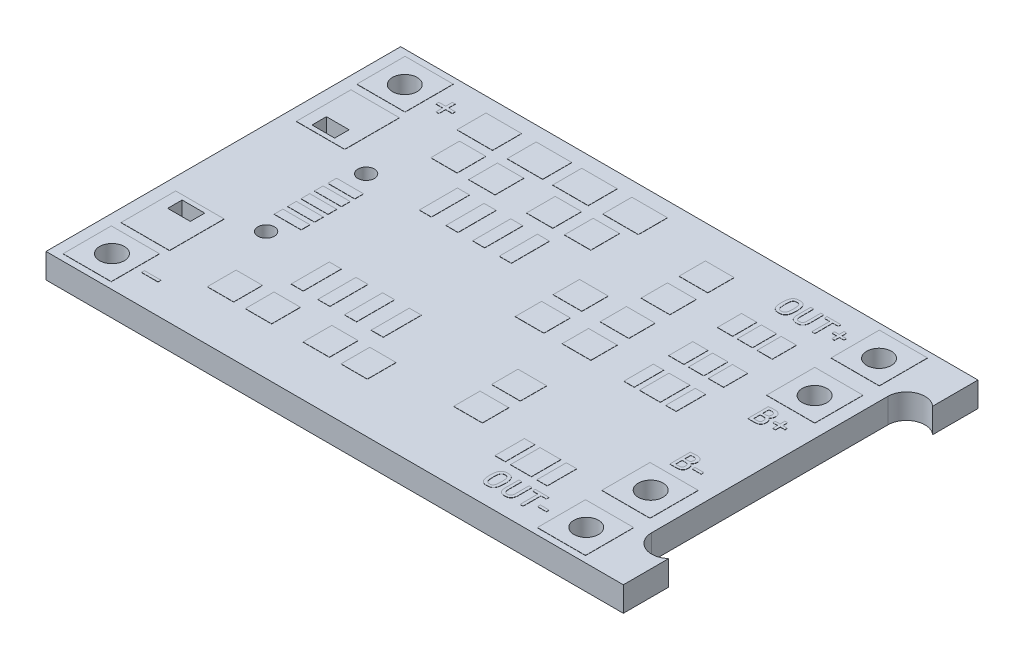
from build123d import *

# Parameters (mm, degrees)
SKETCH1_R                 = 0.6
SKETCH1_R_2               = 0.4
SKETCH1_W                 = 1.1
SKETCH1_H                 = 0.7
PCB_DEPTH                 = 1.2
SKETCH2_W                 = 2.338070763
SKETCH2_H                 = 2.338070764
SKETCH2_R                 = 0.6
SKETCH2_W_2               = 2.349045504
SKETCH2_H_2               = 2.649723328
SKETCH2_W_3               = 1.1
SKETCH2_H_3               = 0.7
SKETCH2_W_4               = 1.724206916
SKETCH2_H_4               = 1.408615472
SKETCH2_W_5               = 1.724206917
SKETCH2_W_6               = 1.277760483
SKETCH2_H_5               = 1.393220768
SKETCH2_W_7               = 0.586321758
SKETCH2_H_6               = 1.84916862
SKETCH2_W_8               = 0.586321757
SKETCH2_W_9               = 1.393220768
SKETCH2_H_7               = 1.277760483
SKETCH2_W_10              = 1.311628833
SKETCH2_H_8               = 0.424893848
SKETCH2_W_11              = 0.738945821
SKETCH2_H_9               = 1.16999755
SKETCH2_W_12              = 0.738945822
SKETCH2_H_10              = 1.169997551
SKETCH2_W_13              = 0.505138745
SKETCH2_H_11              = 1.431226445
SKETCH2_W_14              = 1.010277491
SKETCH2_W_15              = 0.505138746
SKETCH2_H_12              = 1.431226444
SKETCH2_W_16              = 0.8
SKETCH2_H_13              = 0.142340239
PADS_COMPONENT_SIDE_DEPTH = 0.01
PADS_START                = 0.01
SKETCH3_W                 = 2.338070763
SKETCH3_H                 = 2.338070764
SKETCH3_R                 = 0.6
PADS_SOLDER_SIDE_DEPTH    = 0.01
LEGEND_OUT_DEPTH          = 0.01
LEGEND_OUT_2_DEPTH        = 0.01
LEGEND_B_DEPTH            = 0.01
LEGEND_B_2_DEPTH          = 0.01


with BuildPart() as part:
    # Sketch1 → PCB (new body)
    with BuildSketch(Plane(origin=(0, 0, 0), x_dir=(1, 0, 0), z_dir=(0, 1, 0))):
        with BuildLine():
            Line((26.5, 5.729179607), (26.5, -5.729179607))
            ThreePointArc((26.5, -5.729179607), (27.032576539, -6.550763443), (28, -6.4))
            Line((28, -6.4), (28, -8.599973827))
            Line((28, -8.599973827), (0, -8.599973827))
            Line((0, -8.599973827), (0, 8.599973827))
            Line((0, 8.599973827), (28, 8.599973827))
            Line((28, 8.599973827), (28, 6.4))
            ThreePointArc((28, 6.4), (27.032576539, 6.550763443), (26.5, 5.729179607))
        make_face()
        with Locations(Location((24.700000031, 7.100026173, 0), (0, 0, 270))):
            Circle(SKETCH1_R, mode=Mode.SUBTRACT)
        with Locations(Location((1.7, 7.100026173, 0), (0, 0, 270))):
            Circle(SKETCH1_R, mode=Mode.SUBTRACT)
        with Locations(Location((24.700000031, -7.099973827, 0), (0, 0, 270))):
            Circle(SKETCH1_R, mode=Mode.SUBTRACT)
        with Locations(Location((1.7, -7.099973827, 0), (0, 0, 270))):
            Circle(SKETCH1_R, mode=Mode.SUBTRACT)
        with Locations(Location((24.700000031, 3.974726173, 0), (0, 0, 270))):
            Circle(SKETCH1_R, mode=Mode.SUBTRACT)
        with Locations(Location((24.700000031, -3.974973827, 0), (0, 0, 270))):
            Circle(SKETCH1_R, mode=Mode.SUBTRACT)
        with Locations(Location((4.5, 2.425, 0), (0, 0, 270))):
            Circle(SKETCH1_R_2, mode=Mode.SUBTRACT)
        with Locations(Location((4.5, -2.425, 0), (0, 0, 90))):
            Circle(SKETCH1_R_2, mode=Mode.SUBTRACT)
        with Locations((1.7, -3.5)):
            Rectangle(SKETCH1_W, SKETCH1_H, mode=Mode.SUBTRACT)
        with Locations((1.7, 3.5)):
            Rectangle(SKETCH1_W, SKETCH1_H, mode=Mode.SUBTRACT)
    extrude(amount=PCB_DEPTH)

    # Sketch2 → Pads - Component Side (add)
    # profile 1 of 55: a face of its own
    with BuildSketch(Plane(origin=(0, 1.2, 0), x_dir=(1, 0, 0), z_dir=(0, 1, 0))):
        Polygon((3.601592141, 7.180940734), (3.601592141, 7.509770615), (3.743932379, 7.509770615), (3.743932379, 7.180940734), (4.07276226, 7.180940734), (4.07276226, 7.038600496), (3.743932379, 7.038600496), (3.743932379, 6.709770615), (3.601592141, 6.709770615), (3.601592141, 7.038600496), (3.27276226, 7.038600496), (3.27276226, 7.180940734), align=None)
    # profile 2 of 55: a face of its own
    with BuildSketch(Plane(origin=(0, 1.2, 0), x_dir=(1, 0, 0), z_dir=(0, 1, 0))):
        with Locations((1.68941797, 7.123531477)):
            Rectangle(SKETCH2_W, SKETCH2_H)
        with Locations(Location((1.7, 7.100026173, 0), (0, 0, 270))):
            Circle(SKETCH2_R, mode=Mode.SUBTRACT)
    # profile 3 of 55: a face of its own
    with BuildSketch(Plane(origin=(0, 1.2, 0), x_dir=(1, 0, 0), z_dir=(0, 1, 0))):
        with Locations((1.789925252, 4.249464255)):
            Rectangle(SKETCH2_W_2, SKETCH2_H_2)
        with Locations((1.7, 3.5)):
            Rectangle(SKETCH2_W_3, SKETCH2_H_3, mode=Mode.SUBTRACT)
    # profile 4 of 55: a face of its own
    with BuildSketch(Plane(origin=(0, 1.2, 0), x_dir=(1, 0, 0), z_dir=(0, 1, 0))):
        with Locations((1.789925252, -4.249464255)):
            Rectangle(SKETCH2_W_2, SKETCH2_H_2)
        with Locations((1.7, -3.5)):
            Rectangle(SKETCH2_W_3, SKETCH2_H_3, mode=Mode.SUBTRACT)
    # profile 5 of 55: a face of its own
    with BuildSketch(Plane(origin=(0, 1.2, 0), x_dir=(1, 0, 0), z_dir=(0, 1, 0))):
        with Locations((1.68941797, -7.123531477)):
            Rectangle(SKETCH2_W, SKETCH2_H)
        with Locations(Location((1.7, -7.099973827, 0), (0, 0, 270))):
            Circle(SKETCH2_R, mode=Mode.SUBTRACT)
    # profile 6 of 55: a face of its own
    with BuildSketch(Plane(origin=(0, 1.2, 0), x_dir=(1, 0, 0), z_dir=(0, 1, 0))):
        with Locations((5.727104984, 7.170506567)):
            Rectangle(SKETCH2_W_4, SKETCH2_H_4)
    # profile 7 of 55: a face of its own
    with BuildSketch(Plane(origin=(0, 1.2, 0), x_dir=(1, 0, 0), z_dir=(0, 1, 0))):
        with Locations((8.159468313, 7.170506567)):
            Rectangle(SKETCH2_W_4, SKETCH2_H_4)
    # profile 8 of 55: a face of its own
    with BuildSketch(Plane(origin=(0, 1.2, 0), x_dir=(1, 0, 0), z_dir=(0, 1, 0))):
        with Locations((10.368608426, 7.170506567)):
            Rectangle(SKETCH2_W_5, SKETCH2_H_4)
    # profile 9 of 55: a face of its own
    with BuildSketch(Plane(origin=(0, 1.2, 0), x_dir=(1, 0, 0), z_dir=(0, 1, 0))):
        with Locations((12.800971755, 7.170506567)):
            Rectangle(SKETCH2_W_5, SKETCH2_H_4)
    # profile 10 of 55: a face of its own
    with BuildSketch(Plane(origin=(0, 1.2, 0), x_dir=(1, 0, 0), z_dir=(0, 1, 0))):
        with Locations((6.042696429, 5.353931423)):
            Rectangle(SKETCH2_W_6, SKETCH2_H_5)
    # profile 11 of 55: a face of its own
    with BuildSketch(Plane(origin=(0, 1.2, 0), x_dir=(1, 0, 0), z_dir=(0, 1, 0))):
        with Locations((7.882363631, 5.353931423)):
            Rectangle(SKETCH2_W_6, SKETCH2_H_5)
    # profile 12 of 55: a face of its own
    with BuildSketch(Plane(origin=(0, 1.2, 0), x_dir=(1, 0, 0), z_dir=(0, 1, 0))):
        with Locations((10.68419987, 5.353931423)):
            Rectangle(SKETCH2_W_6, SKETCH2_H_5)
    # profile 13 of 55: a face of its own
    with BuildSketch(Plane(origin=(0, 1.2, 0), x_dir=(1, 0, 0), z_dir=(0, 1, 0))):
        with Locations((12.523867071, 5.353931423)):
            Rectangle(SKETCH2_W_6, SKETCH2_H_5)
    # profile 14 of 55: a face of its own
    with BuildSketch(Plane(origin=(0, 1.2, 0), x_dir=(1, 0, 0), z_dir=(0, 1, 0))):
        with Locations((7.615071204, 3.106967226)):
            Rectangle(SKETCH2_W_7, SKETCH2_H_6)
    # profile 15 of 55: a face of its own
    with BuildSketch(Plane(origin=(0, 1.2, 0), x_dir=(1, 0, 0), z_dir=(0, 1, 0))):
        with Locations((8.90798585, 3.106967226)):
            Rectangle(SKETCH2_W_8, SKETCH2_H_6)
    # profile 16 of 55: a face of its own
    with BuildSketch(Plane(origin=(0, 1.2, 0), x_dir=(1, 0, 0), z_dir=(0, 1, 0))):
        with Locations((10.200900495, 3.106967226)):
            Rectangle(SKETCH2_W_7, SKETCH2_H_6)
    # profile 17 of 55: a face of its own
    with BuildSketch(Plane(origin=(0, 1.2, 0), x_dir=(1, 0, 0), z_dir=(0, 1, 0))):
        with Locations((11.49381514, 3.106967226)):
            Rectangle(SKETCH2_W_7, SKETCH2_H_6)
    # profile 18 of 55: a face of its own
    with BuildSketch(Plane(origin=(0, 1.2, 0), x_dir=(1, 0, 0), z_dir=(0, 1, 0))):
        with Locations((17.096721537, 6.341205651)):
            Rectangle(SKETCH2_W_9, SKETCH2_H_7)
    # profile 19 of 55: a face of its own
    with BuildSketch(Plane(origin=(0, 1.2, 0), x_dir=(1, 0, 0), z_dir=(0, 1, 0))):
        with Locations((17.096721537, 4.501538449)):
            Rectangle(SKETCH2_W_9, SKETCH2_H_7)
    # profile 20 of 55: a face of its own
    with BuildSketch(Plane(origin=(0, 1.2, 0), x_dir=(1, 0, 0), z_dir=(0, 1, 0))):
        with Locations((17.096721537, 2.512261479)):
            Rectangle(SKETCH2_W_9, SKETCH2_H_7)
    # profile 21 of 55: a face of its own
    with BuildSketch(Plane(origin=(0, 1.2, 0), x_dir=(1, 0, 0), z_dir=(0, 1, 0))):
        with Locations((17.096721537, 0.672594278)):
            Rectangle(SKETCH2_W_9, SKETCH2_H_7)
    # profile 22 of 55: a face of its own
    with BuildSketch(Plane(origin=(0, 1.2, 0), x_dir=(1, 0, 0), z_dir=(0, 1, 0))):
        with Locations((14.818147398, 2.512261479)):
            Rectangle(SKETCH2_W_9, SKETCH2_H_7)
    # profile 23 of 55: a face of its own
    with BuildSketch(Plane(origin=(0, 1.2, 0), x_dir=(1, 0, 0), z_dir=(0, 1, 0))):
        with Locations((14.818147398, 0.672594278)):
            Rectangle(SKETCH2_W_9, SKETCH2_H_7)
    # profile 24 of 55: a face of its own
    with BuildSketch(Plane(origin=(0, 1.2, 0), x_dir=(1, 0, 0), z_dir=(0, 1, 0))):
        with Locations((4.634015607, 1.3)):
            Rectangle(SKETCH2_W_10, SKETCH2_H_8)
    # profile 25 of 55: a face of its own
    with BuildSketch(Plane(origin=(0, 1.2, 0), x_dir=(1, 0, 0), z_dir=(0, 1, 0))):
        with Locations((4.634015607, 0.65)):
            Rectangle(SKETCH2_W_10, SKETCH2_H_8)
    # profile 26 of 55: a face of its own
    with BuildSketch(Plane(origin=(0, 1.2, 0), x_dir=(1, 0, 0), z_dir=(0, 1, 0))):
        with Locations((4.634015607, 0)):
            Rectangle(SKETCH2_W_10, SKETCH2_H_8)
    # profile 27 of 55: a face of its own
    with BuildSketch(Plane(origin=(0, 1.2, 0), x_dir=(1, 0, 0), z_dir=(0, 1, 0))):
        with Locations((4.634015607, -0.65)):
            Rectangle(SKETCH2_W_10, SKETCH2_H_8)
    # profile 28 of 55: a face of its own
    with BuildSketch(Plane(origin=(0, 1.2, 0), x_dir=(1, 0, 0), z_dir=(0, 1, 0))):
        with Locations((4.634015607, -1.3)):
            Rectangle(SKETCH2_W_10, SKETCH2_H_8)
    # profile 29 of 55: a face of its own
    with BuildSketch(Plane(origin=(0, 1.2, 0), x_dir=(1, 0, 0), z_dir=(0, 1, 0))):
        with Locations((7.615071204, -3.106967226)):
            Rectangle(SKETCH2_W_7, SKETCH2_H_6)
    # profile 30 of 55: a face of its own
    with BuildSketch(Plane(origin=(0, 1.2, 0), x_dir=(1, 0, 0), z_dir=(0, 1, 0))):
        with Locations((8.90798585, -3.106967226)):
            Rectangle(SKETCH2_W_8, SKETCH2_H_6)
    # profile 31 of 55: a face of its own
    with BuildSketch(Plane(origin=(0, 1.2, 0), x_dir=(1, 0, 0), z_dir=(0, 1, 0))):
        with Locations((10.200900495, -3.106967226)):
            Rectangle(SKETCH2_W_7, SKETCH2_H_6)
    # profile 32 of 55: a face of its own
    with BuildSketch(Plane(origin=(0, 1.2, 0), x_dir=(1, 0, 0), z_dir=(0, 1, 0))):
        with Locations((11.49381514, -3.106967226)):
            Rectangle(SKETCH2_W_7, SKETCH2_H_6)
    # profile 33 of 55: a face of its own
    with BuildSketch(Plane(origin=(0, 1.2, 0), x_dir=(1, 0, 0), z_dir=(0, 1, 0))):
        with Locations((6.042696429, -5.481040964)):
            Rectangle(SKETCH2_W_6, SKETCH2_H_5)
    # profile 34 of 55: a face of its own
    with BuildSketch(Plane(origin=(0, 1.2, 0), x_dir=(1, 0, 0), z_dir=(0, 1, 0))):
        with Locations((7.882363631, -5.481040964)):
            Rectangle(SKETCH2_W_6, SKETCH2_H_5)
    # profile 35 of 55: a face of its own
    with BuildSketch(Plane(origin=(0, 1.2, 0), x_dir=(1, 0, 0), z_dir=(0, 1, 0))):
        with Locations((10.68419987, -5.481040964)):
            Rectangle(SKETCH2_W_6, SKETCH2_H_5)
    # profile 36 of 55: a face of its own
    with BuildSketch(Plane(origin=(0, 1.2, 0), x_dir=(1, 0, 0), z_dir=(0, 1, 0))):
        with Locations((12.523867071, -5.481040964)):
            Rectangle(SKETCH2_W_6, SKETCH2_H_5)
    # profile 37 of 55: a face of its own
    with BuildSketch(Plane(origin=(0, 1.2, 0), x_dir=(1, 0, 0), z_dir=(0, 1, 0))):
        with Locations((17.096721537, -2.749600451)):
            Rectangle(SKETCH2_W_9, SKETCH2_H_7)
    # profile 38 of 55: a face of its own
    with BuildSketch(Plane(origin=(0, 1.2, 0), x_dir=(1, 0, 0), z_dir=(0, 1, 0))):
        with Locations((17.096721537, -4.589267652)):
            Rectangle(SKETCH2_W_9, SKETCH2_H_7)
    # profile 39 of 55: a face of its own
    with BuildSketch(Plane(origin=(0, 1.2, 0), x_dir=(1, 0, 0), z_dir=(0, 1, 0))):
        with Locations((19.851062426, 5.06548038)):
            Rectangle(SKETCH2_W_11, SKETCH2_H_9)
    # profile 40 of 55: a face of its own
    with BuildSketch(Plane(origin=(0, 1.2, 0), x_dir=(1, 0, 0), z_dir=(0, 1, 0))):
        with Locations((20.813231464, 5.06548038)):
            Rectangle(SKETCH2_W_12, SKETCH2_H_9)
    # profile 41 of 55: a face of its own
    with BuildSketch(Plane(origin=(0, 1.2, 0), x_dir=(1, 0, 0), z_dir=(0, 1, 0))):
        with Locations((21.775400503, 5.06548038)):
            Rectangle(SKETCH2_W_11, SKETCH2_H_9)
    # profile 42 of 55: a face of its own
    with BuildSketch(Plane(origin=(0, 1.2, 0), x_dir=(1, 0, 0), z_dir=(0, 1, 0))):
        with Locations((19.851062426, 2.702393222)):
            Rectangle(SKETCH2_W_11, SKETCH2_H_10)
    # profile 43 of 55: a face of its own
    with BuildSketch(Plane(origin=(0, 1.2, 0), x_dir=(1, 0, 0), z_dir=(0, 1, 0))):
        with Locations((20.813231464, 2.702393222)):
            Rectangle(SKETCH2_W_12, SKETCH2_H_10)
    # profile 44 of 55: a face of its own
    with BuildSketch(Plane(origin=(0, 1.2, 0), x_dir=(1, 0, 0), z_dir=(0, 1, 0))):
        with Locations((21.775400503, 2.702393222)):
            Rectangle(SKETCH2_W_11, SKETCH2_H_10)
    # profile 45 of 55: a face of its own
    with BuildSketch(Plane(origin=(0, 1.2, 0), x_dir=(1, 0, 0), z_dir=(0, 1, 0))):
        with Locations((19.722615502, 0.670713408)):
            Rectangle(SKETCH2_W_13, SKETCH2_H_11)
    # profile 46 of 55: a face of its own
    with BuildSketch(Plane(origin=(0, 1.2, 0), x_dir=(1, 0, 0), z_dir=(0, 1, 0))):
        with Locations((20.732892992, 0.670713408)):
            Rectangle(SKETCH2_W_14, SKETCH2_H_11)
    # profile 47 of 55: a face of its own
    with BuildSketch(Plane(origin=(0, 1.2, 0), x_dir=(1, 0, 0), z_dir=(0, 1, 0))):
        with Locations((21.755197596, 0.670713408)):
            Rectangle(SKETCH2_W_15, SKETCH2_H_11)
    # profile 48 of 55: a face of its own
    with BuildSketch(Plane(origin=(0, 1.2, 0), x_dir=(1, 0, 0), z_dir=(0, 1, 0))):
        with Locations((19.722615502, -5.583385342)):
            Rectangle(SKETCH2_W_13, SKETCH2_H_12)
    # profile 49 of 55: a face of its own
    with BuildSketch(Plane(origin=(0, 1.2, 0), x_dir=(1, 0, 0), z_dir=(0, 1, 0))):
        with Locations((20.732892992, -5.583385342)):
            Rectangle(SKETCH2_W_14, SKETCH2_H_12)
    # profile 50 of 55: a face of its own
    with BuildSketch(Plane(origin=(0, 1.2, 0), x_dir=(1, 0, 0), z_dir=(0, 1, 0))):
        with Locations((21.755197596, -5.583385342)):
            Rectangle(SKETCH2_W_15, SKETCH2_H_12)
    # profile 51 of 55: a face of its own
    with BuildSketch(Plane(origin=(0, 1.2, 0), x_dir=(1, 0, 0), z_dir=(0, 1, 0))):
        with Locations((24.689418001, -7.123531477)):
            Rectangle(SKETCH2_W, SKETCH2_H)
        with Locations(Location((24.700000031, -7.099973827, 0), (0, 0, 270))):
            Circle(SKETCH2_R, mode=Mode.SUBTRACT)
    # profile 52 of 55: a face of its own
    with BuildSketch(Plane(origin=(0, 1.2, 0), x_dir=(1, 0, 0), z_dir=(0, 1, 0))):
        with Locations((24.689418001, -3.996012293)):
            Rectangle(SKETCH2_W, SKETCH2_H)
        with Locations(Location((24.700000031, -3.974973827, 0), (0, 0, 270))):
            Circle(SKETCH2_R, mode=Mode.SUBTRACT)
    # profile 53 of 55: a face of its own
    with BuildSketch(Plane(origin=(0, 1.2, 0), x_dir=(1, 0, 0), z_dir=(0, 1, 0))):
        with Locations((24.689418001, 3.996012293)):
            Rectangle(SKETCH2_W, SKETCH2_H)
        with Locations(Location((24.700000031, 3.974726173, 0), (0, 0, 270))):
            Circle(SKETCH2_R, mode=Mode.SUBTRACT)
    # profile 54 of 55: a face of its own
    with BuildSketch(Plane(origin=(0, 1.2, 0), x_dir=(1, 0, 0), z_dir=(0, 1, 0))):
        with Locations((24.689418001, 7.123531477)):
            Rectangle(SKETCH2_W, SKETCH2_H)
        with Locations(Location((24.700000031, 7.100026173, 0), (0, 0, 270))):
            Circle(SKETCH2_R, mode=Mode.SUBTRACT)
    # profile 55 of 55: a face of its own
    with BuildSketch(Plane(origin=(0, 1.2, 0), x_dir=(1, 0, 0), z_dir=(0, 1, 0))):
        with Locations((3.601592141, -7.099973827)):
            Rectangle(SKETCH2_W_16, SKETCH2_H_13)
    extrude(amount=PADS_COMPONENT_SIDE_DEPTH)

    # Sketch3 → Pads - Solder side (add)
    # profile 1 of 6: a face of its own
    with BuildSketch(Plane.XZ.offset(PADS_START)):
        with Locations((1.68941797, 7.123531477)):
            Rectangle(SKETCH3_W, SKETCH3_H)
        with Locations(Location((1.7, 7.099973827, 0), (0, 0, 270))):
            Circle(SKETCH3_R, mode=Mode.SUBTRACT)
    # profile 2 of 6: a face of its own
    with BuildSketch(Plane.XZ.offset(PADS_START)):
        with Locations((1.68941797, -7.123531477)):
            Rectangle(SKETCH3_W, SKETCH3_H)
        with Locations(Location((1.7, -7.100026173, 0), (0, 0, 270))):
            Circle(SKETCH3_R, mode=Mode.SUBTRACT)
    # profile 3 of 6: a face of its own
    with BuildSketch(Plane.XZ.offset(PADS_START)):
        with Locations((24.689418001, 7.123531477)):
            Rectangle(SKETCH3_W, SKETCH3_H)
        with Locations(Location((24.700000031, 7.099973827, 0), (0, 0, 270))):
            Circle(SKETCH3_R, mode=Mode.SUBTRACT)
    # profile 4 of 6: a face of its own
    with BuildSketch(Plane.XZ.offset(PADS_START)):
        with Locations((24.689418001, -7.123531477)):
            Rectangle(SKETCH3_W, SKETCH3_H)
        with Locations(Location((24.700000031, -7.100026173, 0), (0, 0, 270))):
            Circle(SKETCH3_R, mode=Mode.SUBTRACT)
    # profile 5 of 6: a face of its own
    with BuildSketch(Plane.XZ.offset(PADS_START)):
        with Locations((24.689418001, -3.996012293)):
            Rectangle(SKETCH3_W, SKETCH3_H)
        with Locations(Location((24.700000031, -3.974726173, 0), (0, 0, 270))):
            Circle(SKETCH3_R, mode=Mode.SUBTRACT)
    # profile 6 of 6: a face of its own
    with BuildSketch(Plane.XZ.offset(PADS_START)):
        with Locations((24.689418001, 3.996012293)):
            Rectangle(SKETCH3_W, SKETCH3_H)
        with Locations(Location((24.700000031, 3.974973827, 0), (0, 0, 270))):
            Circle(SKETCH3_R, mode=Mode.SUBTRACT)
    extrude(amount=-PADS_SOLDER_SIDE_DEPTH)

    # Sketch4 → Legend - Out (add)
    # profile 1 of 4: a face of its own
    with BuildSketch(Plane(origin=(0, 1.2, 0), x_dir=(1, 0, 0), z_dir=(0, 1, 0))):
        with BuildLine():
            Line((22.859051248, 7.137747739), (23.052176248, 7.137747739))
            add(Edge.make_bspline(
                [(23.052176248, 7.137747739), (23.057107042, 7.137430739), (23.066128911, 7.136850725), (23.078201542, 7.130510007), (23.084880308, 7.118649923), (23.085422601, 7.109703164), (23.085717914, 7.104831072)],
                knots=[0, 0, 0, 0, 1.098803929, 2.010480165, 2.916577097, 4, 4, 4, 4], degree=3))
            Line((23.085717914, 7.104831072), (23.085717914, 7.017747739))
            Line((23.085717914, 7.017747739), (22.859051248, 7.017747739))
            Line((22.859051248, 7.017747739), (22.859051248, 6.777747739))
            Line((22.859051248, 6.777747739), (22.759884581, 6.777747739))
            add(Edge.make_bspline(
                [(22.759884581, 6.777747739), (22.754784076, 6.777999665), (22.745495841, 6.778458433), (22.733416921, 6.785542837), (22.726475314, 6.797693035), (22.72598528, 6.807028995), (22.725717914, 6.812122739)],
                knots=[0, 0, 0, 0, 1.094729443, 1.993548665, 2.905270557, 4, 4, 4, 4], degree=3))
            Line((22.725717914, 6.812122739), (22.725717914, 7.017747739))
            Line((22.725717914, 7.017747739), (22.534051248, 7.017747739))
            add(Edge.make_bspline(
                [(22.534051248, 7.017747739), (22.528903185, 7.018039183), (22.519499997, 7.01857152), (22.507171509, 7.025104559), (22.500027583, 7.036817286), (22.499396261, 7.045771172), (22.499051248, 7.050664406)],
                knots=[0, 0, 0, 0, 1.123037422, 2.051282647, 2.935040248, 4, 4, 4, 4], degree=3))
            Line((22.499051248, 7.050664406), (22.499051248, 7.137747739))
            Line((22.499051248, 7.137747739), (22.725717914, 7.137747739))
            Line((22.725717914, 7.137747739), (22.725717914, 7.377747739))
            Line((22.725717914, 7.377747739), (22.824884581, 7.377747739))
            add(Edge.make_bspline(
                [(22.824884581, 7.377747739), (22.829985086, 7.377495813), (22.83927332, 7.377037045), (22.851352241, 7.369952641), (22.858293847, 7.357802443), (22.858783882, 7.348466483), (22.859051248, 7.343372739)],
                knots=[0, 0, 0, 0, 1.094729443, 1.993548665, 2.905270557, 4, 4, 4, 4], degree=3))
            Line((22.859051248, 7.343372739), (22.859051248, 7.137747739))
        make_face()
    # profile 2 of 4: a face of its own
    with BuildSketch(Plane(origin=(0, 1.2, 0), x_dir=(1, 0, 0), z_dir=(0, 1, 0))):
        with BuildLine():
            Line((21.952384581, 7.457747739), (21.720717914, 7.457747739))
            add(Edge.make_bspline(
                [(21.720717914, 7.457747739), (21.715552981, 7.458001802), (21.706048203, 7.458469341), (21.693703018, 7.465617303), (21.686686451, 7.477977496), (21.686061361, 7.487375694), (21.685717914, 7.492539406)],
                knots=[0, 0, 0, 0, 1.09175802, 2.009109741, 2.906132495, 4, 4, 4, 4], degree=3))
            Line((21.685717914, 7.492539406), (21.685717914, 7.591081072))
            Line((21.685717914, 7.591081072), (22.331134581, 7.591081072))
            add(Edge.make_bspline(
                [(22.331134581, 7.591081072), (22.335967088, 7.590713842), (22.345179607, 7.590013768), (22.356979461, 7.582611767), (22.364848046, 7.570792739), (22.365414268, 7.561352114), (22.365717914, 7.556289406)],
                knots=[0, 0, 0, 0, 1.038606084, 1.9799616, 2.916717433, 4, 4, 4, 4], degree=3))
            Line((22.365717914, 7.556289406), (22.365717914, 7.457747739))
            Line((22.365717914, 7.457747739), (22.099051248, 7.457747739))
            Line((22.099051248, 7.457747739), (22.099051248, 6.591081072))
            Line((22.099051248, 6.591081072), (21.985926248, 6.591081072))
            add(Edge.make_bspline(
                [(21.985926248, 6.591081072), (21.980980101, 6.591375419), (21.971895121, 6.591916068), (21.960032655, 6.598536743), (21.953160635, 6.610194235), (21.952659381, 6.61910992), (21.952384581, 6.623997739)],
                knots=[0, 0, 0, 0, 1.100319274, 2.021043931, 2.915082964, 4, 4, 4, 4], degree=3))
            Line((21.952384581, 6.623997739), (21.952384581, 7.457747739))
        make_face()
    # profile 3 of 4: a face of its own
    with BuildSketch(Plane(origin=(0, 1.2, 0), x_dir=(1, 0, 0), z_dir=(0, 1, 0))):
        with BuildLine():
            add(Edge.make_bspline(
                [(21.539051248, 6.946289406), (21.538784103, 6.931006602), (21.538266155, 6.901375774), (21.535069952, 6.858490749), (21.529241262, 6.818747771), (21.52121193, 6.782150683), (21.51082364, 6.748668869), (21.498217679, 6.718184099), (21.48288678, 6.691025322), (21.465598625, 6.66661738), (21.445234198, 6.645521695), (21.422067424, 6.627195251), (21.395889402, 6.611799852), (21.366756069, 6.599252431), (21.334695992, 6.589448127), (21.299621656, 6.582801432), (21.261655766, 6.578537341), (21.23538301, 6.578017366), (21.221759581, 6.577747739)],
                knots=[0, 0, 0, 0, 1.305152066, 2.530474064, 3.669401321, 4.732663706, 5.726763857, 6.659651809, 7.543824186, 8.384882684, 9.206952069, 10.038654786, 10.900101658, 11.792489312, 12.741671524, 13.757001279, 14.836919302, 16, 16, 16, 16], degree=3))
            add(Edge.make_bspline(
                [(21.221759581, 6.577747739), (21.20917856, 6.577885664), (21.184726704, 6.578153729), (21.149135314, 6.582016948), (21.115563153, 6.58711328), (21.084131195, 6.595019455), (21.054990802, 6.60557402), (21.028217565, 6.61913873), (21.00410123, 6.636046379), (20.982128514, 6.655737738), (20.962741678, 6.679052217), (20.945994277, 6.70582339), (20.931460582, 6.7359791), (20.919675299, 6.769820434), (20.910247622, 6.807668416), (20.903867765, 6.849934302), (20.899562417, 6.896617144), (20.899226447, 6.929264642), (20.899051248, 6.946289406)],
                knots=[0, 0, 0, 0, 1.063074196, 2.066138944, 3.023632117, 3.932117013, 4.80139653, 5.639011141, 6.461488956, 7.284532357, 8.126456875, 9.015787792, 9.947980673, 10.950718906, 12.040041054, 13.240791922, 14.56114961, 16, 16, 16, 16], degree=3))
            Line((20.899051248, 6.946289406), (20.899051248, 7.591081072))
            Line((20.899051248, 7.591081072), (21.012176248, 7.591081072))
            add(Edge.make_bspline(
                [(21.012176248, 7.591081072), (21.017107042, 7.590764072), (21.026128911, 7.590184058), (21.038201542, 7.583843341), (21.044880308, 7.571983256), (21.045422601, 7.563036497), (21.045717914, 7.558164406)],
                knots=[0, 0, 0, 0, 1.098803929, 2.010480165, 2.916577097, 4, 4, 4, 4], degree=3))
            Line((21.045717914, 7.558164406), (21.045717914, 6.934206072))
            add(Edge.make_bspline(
                [(21.045717914, 6.934206072), (21.04577514, 6.925870142), (21.045887301, 6.909531938), (21.047426682, 6.885697369), (21.04964983, 6.863021569), (21.052914372, 6.841642791), (21.057352886, 6.821583865), (21.06355719, 6.803110481), (21.070655473, 6.785918587), (21.079689272, 6.770363904), (21.090399968, 6.756493498), (21.102762033, 6.744211331), (21.117095266, 6.734008284), (21.133231017, 6.725457937), (21.151662625, 6.719111852), (21.172375448, 6.714268628), (21.195656411, 6.711733582), (21.211962679, 6.711305468), (21.220509581, 6.711081072)],
                knots=[0, 0, 0, 0, 1.216430547, 2.384171921, 3.484470507, 4.540948917, 5.539181241, 6.478290042, 7.381943698, 8.249403933, 9.094793265, 9.93335007, 10.782860911, 11.653335736, 12.589431493, 13.619570712, 14.752302219, 16, 16, 16, 16], degree=3))
            add(Edge.make_bspline(
                [(21.220509581, 6.711081072), (21.228848118, 6.711305563), (21.244738958, 6.711733379), (21.267402312, 6.714259609), (21.287551647, 6.719137856), (21.305564457, 6.725489834), (21.321366066, 6.734031445), (21.335561949, 6.743984545), (21.347632118, 6.756064596), (21.358280132, 6.769593107), (21.367111863, 6.78488586), (21.374755348, 6.801653179), (21.380434089, 6.82018592), (21.385023282, 6.840171806), (21.388229908, 6.861851948), (21.390735022, 6.884990145), (21.39221354, 6.909811845), (21.392326218, 6.926842969), (21.392384581, 6.935664406)],
                knots=[0, 0, 0, 0, 1.221332142, 2.32750579, 3.331351107, 4.251401777, 5.115762057, 5.953882981, 6.780825146, 7.60670372, 8.468247999, 9.360337453, 10.299410707, 11.300935588, 12.360898675, 13.50633898, 14.708383921, 16, 16, 16, 16], degree=3))
            Line((21.392384581, 6.935664406), (21.392384581, 7.591081072))
            Line((21.392384581, 7.591081072), (21.505509581, 7.591081072))
            add(Edge.make_bspline(
                [(21.505509581, 7.591081072), (21.510206158, 7.590790505), (21.519138804, 7.590237863), (21.530477583, 7.582973322), (21.538078112, 7.571735745), (21.538713627, 7.562736796), (21.539051248, 7.557956072)],
                knots=[0, 0, 0, 0, 1.048069957, 1.993374372, 2.93397315, 4, 4, 4, 4], degree=3))
            Line((21.539051248, 7.557956072), (21.539051248, 6.946289406))
        make_face()
    # profile 4 of 4: a face of its own
    with BuildSketch(Plane(origin=(0, 1.2, 0), x_dir=(1, 0, 0), z_dir=(0, 1, 0))):
        with BuildLine():
            add(Edge.make_bspline(
                [(20.712384581, 7.091081072), (20.712317746, 7.078093376), (20.712187617, 7.052806156), (20.71079669, 7.015791833), (20.709148407, 6.980618217), (20.706036072, 6.94723072), (20.702752588, 6.915639376), (20.69798798, 6.885942909), (20.692910245, 6.858043624), (20.686908955, 6.831886577), (20.679812457, 6.807460818), (20.672859933, 6.784264175), (20.664230969, 6.762824648), (20.655664089, 6.742448102), (20.645983686, 6.7236439), (20.636134594, 6.705880787), (20.62498257, 6.689986982), (20.609881271, 6.670541758), (20.588947471, 6.649349395), (20.561586901, 6.62748336), (20.531336005, 6.61047749), (20.498827988, 6.59787822), (20.464436825, 6.588868606), (20.428409684, 6.582470404), (20.39067361, 6.578374626), (20.364895344, 6.57795935), (20.351759581, 6.577747739)],
                knots=[0, 0, 0, 0, 1.291338966, 2.51425449, 3.682880323, 4.791927438, 5.848055963, 6.840287001, 7.781544293, 8.667613956, 9.507038461, 10.310711405, 11.073692644, 11.803584825, 12.507674271, 13.175728529, 13.821204133, 14.435918619, 15.622501783, 16.773200826, 17.908044666, 19.05824636, 20.230741893, 21.437565722, 22.694267093, 24, 24, 24, 24], degree=3))
            add(Edge.make_bspline(
                [(20.351759581, 6.577747739), (20.33862349, 6.577955928), (20.312913667, 6.578363392), (20.275250456, 6.582490426), (20.239356228, 6.588848007), (20.205155361, 6.597835523), (20.172964264, 6.61053545), (20.142959515, 6.627476875), (20.115798196, 6.64941313), (20.094918609, 6.670560012), (20.079748824, 6.68991581), (20.068913444, 6.706011975), (20.058720869, 6.723565993), (20.049146671, 6.742468396), (20.040462143, 6.762768582), (20.032239894, 6.784356586), (20.024869273, 6.807409223), (20.017887166, 6.831895613), (20.01185103, 6.858040981), (20.006783475, 6.885943677), (20.002015902, 6.915639151), (19.998733284, 6.947230786), (19.995620698, 6.980618198), (19.993972488, 7.015791839), (19.99258154, 7.052806155), (19.992451414, 7.078093376), (19.992384581, 7.091081072)],
                knots=[0, 0, 0, 0, 1.30783659, 2.559684363, 3.768452522, 4.936158407, 6.075352812, 7.206012226, 8.353136179, 9.541631062, 10.157335922, 10.799955299, 11.472544114, 12.177767927, 12.908836047, 13.670570057, 14.477644631, 15.318421543, 16.205918764, 17.148692528, 18.142522161, 19.200352228, 20.311186142, 21.481694763, 22.706580541, 24, 24, 24, 24], degree=3))
            add(Edge.make_bspline(
                [(19.992384581, 7.091081072), (19.992451694, 7.104068743), (19.992582363, 7.129355914), (19.993969455, 7.166370586), (19.995634559, 7.201612083), (19.998704416, 7.23500372), (20.0020352, 7.266590259), (20.006781335, 7.296218722), (20.011851811, 7.324120986), (20.017886099, 7.350266968), (20.024872569, 7.374751454), (20.032228497, 7.397810667), (20.04052423, 7.419435524), (20.04903472, 7.439815991), (20.058786099, 7.458633135), (20.068906315, 7.476152789), (20.079745612, 7.492251053), (20.094974712, 7.511613282), (20.115638276, 7.533006276), (20.143110798, 7.554596438), (20.172838978, 7.571946772), (20.205218808, 7.58424684), (20.239345345, 7.593338397), (20.275253513, 7.599664904), (20.312912851, 7.603800571), (20.338623214, 7.604206832), (20.351759581, 7.604414406)],
                knots=[0, 0, 0, 0, 1.293323479, 2.518118364, 3.688540126, 4.806181222, 5.857060151, 6.850816036, 7.793519841, 8.680951204, 9.521665726, 10.328680409, 11.090357895, 11.827723287, 12.5267297, 13.199268605, 13.841840295, 14.457499467, 15.650866114, 16.793623023, 17.927641074, 19.064207886, 20.23182712, 21.440505581, 22.692260459, 24, 24, 24, 24], degree=3))
            add(Edge.make_bspline(
                [(20.351759581, 7.604414406), (20.364895615, 7.604203404), (20.390674412, 7.603789323), (20.428406669, 7.599684953), (20.464447513, 7.593317608), (20.498765174, 7.58420397), (20.531460783, 7.572005812), (20.561436038, 7.554589105), (20.589107158, 7.533070428), (20.609825415, 7.511631683), (20.624985789, 7.492179907), (20.636141838, 7.476284044), (20.645919443, 7.458555791), (20.655776057, 7.439836323), (20.664167915, 7.419379083), (20.672871225, 7.397903039), (20.679809189, 7.374699869), (20.686910015, 7.350276001), (20.692909466, 7.324118344), (20.697990119, 7.29621949), (20.702733295, 7.266590036), (20.706064941, 7.235003786), (20.709134546, 7.201612064), (20.710799722, 7.166370592), (20.712186794, 7.129355912), (20.712317467, 7.104068742), (20.712384581, 7.091081072)],
                knots=[0, 0, 0, 0, 1.305634511, 2.56224118, 3.768974067, 4.941381244, 6.088985703, 7.227162895, 8.373520409, 9.56496613, 10.179634293, 10.825061256, 11.493065171, 12.190946414, 12.927124891, 13.690048634, 14.493661016, 15.333022264, 16.219025156, 17.160211518, 18.152367784, 19.201555145, 20.317397207, 21.485934976, 22.708758345, 24, 24, 24, 24], degree=3))
        make_face()
        with BuildLine():
            add(Edge.make_bspline(
                [(20.152384581, 7.091081072), (20.152508341, 7.073787794), (20.152745485, 7.040651113), (20.15441977, 6.993205551), (20.15699264, 6.95018149), (20.1609018, 6.911454104), (20.166068348, 6.876657381), (20.173498632, 6.84565964), (20.181986582, 6.817976174), (20.192642148, 6.793757123), (20.205121813, 6.772848856), (20.219734071, 6.755205393), (20.23621092, 6.740688802), (20.25487359, 6.729390904), (20.275647707, 6.721027165), (20.298864811, 6.715307855), (20.3244988, 6.711774665), (20.342441913, 6.711318141), (20.351759581, 6.711081072)],
                knots=[0, 0, 0, 0, 1.686764045, 3.232109191, 4.63025915, 5.889978029, 7.028114374, 8.058267767, 8.996560439, 9.848696707, 10.632833935, 11.363950177, 12.074442337, 12.764491927, 13.481476844, 14.250339606, 15.091419963, 16, 16, 16, 16], degree=3))
            add(Edge.make_bspline(
                [(20.351759581, 6.711081072), (20.361077221, 6.711318164), (20.37902028, 6.711774732), (20.404654639, 6.715307619), (20.427870502, 6.721027947), (20.448648821, 6.729388237), (20.467296447, 6.740698481), (20.48379775, 6.755138296), (20.498161719, 6.772927026), (20.510694518, 6.793741339), (20.521279194, 6.818016194), (20.530042347, 6.84564244), (20.537677472, 6.876648119), (20.542979251, 6.911461756), (20.547457029, 6.950159607), (20.550113251, 6.993205252), (20.552091588, 7.040645814), (20.552284114, 7.073786864), (20.552384581, 7.091081072)],
                knots=[0, 0, 0, 0, 0.908434488, 1.749380107, 2.518119702, 3.234989761, 3.924928809, 4.635307152, 5.361995412, 6.146007026, 6.998006786, 7.938224768, 8.969792823, 10.108814485, 11.3697874, 12.768156265, 14.313506166, 16, 16, 16, 16], degree=3))
            add(Edge.make_bspline(
                [(20.552384581, 7.091081072), (20.552284113, 7.108375279), (20.552091584, 7.141516327), (20.550113266, 7.188956906), (20.547456982, 7.232002496), (20.542979402, 7.270700522), (20.537676989, 7.305513598), (20.530043907, 7.336521085), (20.521274132, 7.36414147), (20.510710934, 7.388435335), (20.498079389, 7.409233164), (20.483941702, 7.427235144), (20.467213806, 7.441440275), (20.448660854, 7.452786915), (20.427866973, 7.461130383), (20.404655707, 7.46685568), (20.379019977, 7.470387085), (20.361077117, 7.470843869), (20.351759581, 7.471081072)],
                knots=[0, 0, 0, 0, 1.686407966, 3.231679185, 4.629976851, 5.890885564, 7.029849233, 8.061364765, 9.001534875, 9.853491256, 10.637462951, 11.369365401, 12.075271029, 12.765174949, 13.482008509, 14.250708963, 15.091611766, 16, 16, 16, 16], degree=3))
            add(Edge.make_bspline(
                [(20.351759581, 7.471081072), (20.342442016, 7.470843892), (20.324499102, 7.470387151), (20.298863744, 7.466855445), (20.275651233, 7.46113116), (20.254861568, 7.452784267), (20.236293553, 7.441449859), (20.219589885, 7.427169156), (20.205203802, 7.409310705), (20.192625774, 7.388419664), (20.181991619, 7.364181466), (20.17349708, 7.336503892), (20.166068829, 7.305504334), (20.16090165, 7.270708175), (20.156992687, 7.231980613), (20.154419755, 7.188956607), (20.152745489, 7.141511028), (20.152508342, 7.108374349), (20.152384581, 7.091081072)],
                knots=[0, 0, 0, 0, 0.908535516, 1.749574658, 2.518399745, 3.235349528, 3.925365305, 4.631385385, 5.36768709, 6.151785894, 7.003880406, 7.9421271, 8.972230014, 10.110310589, 11.369967739, 12.768049187, 14.313318609, 16, 16, 16, 16], degree=3))
        make_face(mode=Mode.SUBTRACT)
    extrude(amount=LEGEND_OUT_DEPTH)

    # Sketch5 → Legend - Out 2 (add)
    # profile 1 of 4: a face of its own
    with BuildSketch(Plane(origin=(0, 1.2, 0), x_dir=(1, 0, 0), z_dir=(0, 1, 0))):
        with BuildLine():
            add(Edge.make_bspline(
                [(23.040371989, -7.272368757), (23.045465733, -7.272636122), (23.054801692, -7.273126157), (23.066951891, -7.280067763), (23.074036295, -7.292146684), (23.074495063, -7.301434919), (23.074746989, -7.306535423)],
                knots=[0, 0, 0, 0, 1.094729443, 2.006451335, 2.905270557, 4, 4, 4, 4], degree=3))
            Line((23.074746989, -7.306535423), (23.074746989, -7.40570209))
            Line((23.074746989, -7.40570209), (22.682455322, -7.40570209))
            add(Edge.make_bspline(
                [(22.682455322, -7.40570209), (22.677361578, -7.405434725), (22.668025618, -7.40494469), (22.65587542, -7.398003083), (22.648791016, -7.385924163), (22.648332248, -7.376635928), (22.648080322, -7.371535423)],
                knots=[0, 0, 0, 0, 1.094729443, 2.006451335, 2.905270557, 4, 4, 4, 4], degree=3))
            Line((22.648080322, -7.371535423), (22.648080322, -7.272368757))
            Line((22.648080322, -7.272368757), (23.040371989, -7.272368757))
        make_face()
    # profile 2 of 4: a face of its own
    with BuildSketch(Plane(origin=(0, 1.2, 0), x_dir=(1, 0, 0), z_dir=(0, 1, 0))):
        with BuildLine():
            Line((22.128080322, -6.872368757), (21.896413655, -6.872368757))
            add(Edge.make_bspline(
                [(21.896413655, -6.872368757), (21.891248722, -6.872114694), (21.881743944, -6.871647154), (21.869398759, -6.864499192), (21.862382192, -6.852139), (21.861757102, -6.842740802), (21.861413655, -6.83757709)],
                knots=[0, 0, 0, 0, 1.09175802, 2.009109741, 2.906132495, 4, 4, 4, 4], degree=3))
            Line((21.861413655, -6.83757709), (21.861413655, -6.739035423))
            Line((21.861413655, -6.739035423), (22.506830322, -6.739035423))
            add(Edge.make_bspline(
                [(22.506830322, -6.739035423), (22.511662829, -6.739402653), (22.520875348, -6.740102728), (22.532675202, -6.747504729), (22.540543787, -6.759323757), (22.541110009, -6.768764382), (22.541413655, -6.77382709)],
                knots=[0, 0, 0, 0, 1.038606084, 1.9799616, 2.916717433, 4, 4, 4, 4], degree=3))
            Line((22.541413655, -6.77382709), (22.541413655, -6.872368757))
            Line((22.541413655, -6.872368757), (22.274746989, -6.872368757))
            Line((22.274746989, -6.872368757), (22.274746989, -7.739035423))
            Line((22.274746989, -7.739035423), (22.161621989, -7.739035423))
            add(Edge.make_bspline(
                [(22.161621989, -7.739035423), (22.156675842, -7.738741077), (22.147590862, -7.738200427), (22.135728396, -7.731579753), (22.128856376, -7.71992226), (22.128355123, -7.711006575), (22.128080322, -7.706118757)],
                knots=[0, 0, 0, 0, 1.100319274, 2.021043931, 2.915082964, 4, 4, 4, 4], degree=3))
            Line((22.128080322, -7.706118757), (22.128080322, -6.872368757))
        make_face()
    # profile 3 of 4: a face of its own
    with BuildSketch(Plane(origin=(0, 1.2, 0), x_dir=(1, 0, 0), z_dir=(0, 1, 0))):
        with BuildLine():
            add(Edge.make_bspline(
                [(21.714746989, -7.38382709), (21.714479844, -7.399109893), (21.713961896, -7.428740722), (21.710765693, -7.471625747), (21.704937003, -7.511368724), (21.696907671, -7.547965812), (21.686519381, -7.581447627), (21.67391342, -7.611932396), (21.658582521, -7.639091174), (21.641294366, -7.663499115), (21.62092994, -7.6845948), (21.597763165, -7.702921244), (21.571585143, -7.718316643), (21.54245181, -7.730864065), (21.510391733, -7.740668368), (21.475317397, -7.747315063), (21.437351507, -7.751579154), (21.411078751, -7.752099129), (21.397455322, -7.752368757)],
                knots=[0, 0, 0, 0, 1.305152066, 2.530474064, 3.669401321, 4.732663706, 5.726763857, 6.659651809, 7.543824186, 8.384882684, 9.206952069, 10.038654786, 10.900101658, 11.792489312, 12.741671524, 13.757001279, 14.836919302, 16, 16, 16, 16], degree=3))
            add(Edge.make_bspline(
                [(21.397455322, -7.752368757), (21.384874301, -7.752230831), (21.360422445, -7.751962767), (21.324831055, -7.748099547), (21.291258894, -7.743003216), (21.259826936, -7.73509704), (21.230686543, -7.724542475), (21.203913306, -7.710977766), (21.179796971, -7.694070116), (21.157824255, -7.674378757), (21.13843742, -7.651064279), (21.121690019, -7.624293105), (21.107156324, -7.594137396), (21.09537104, -7.560296062), (21.085943363, -7.52244808), (21.079563506, -7.480182194), (21.075258158, -7.433499351), (21.074922188, -7.400851853), (21.074746989, -7.38382709)],
                knots=[0, 0, 0, 0, 1.063074196, 2.066138944, 3.023632117, 3.932117013, 4.80139653, 5.639011141, 6.461488956, 7.284532357, 8.126456875, 9.015787792, 9.947980673, 10.950718906, 12.040041054, 13.240791922, 14.56114961, 16, 16, 16, 16], degree=3))
            Line((21.074746989, -7.38382709), (21.074746989, -6.739035423))
            Line((21.074746989, -6.739035423), (21.187871989, -6.739035423))
            add(Edge.make_bspline(
                [(21.187871989, -6.739035423), (21.192802783, -6.739352423), (21.201824652, -6.739932437), (21.213897283, -6.746273155), (21.220576049, -6.758133239), (21.221118342, -6.767079998), (21.221413655, -6.77195209)],
                knots=[0, 0, 0, 0, 1.098803929, 2.010480165, 2.916577097, 4, 4, 4, 4], degree=3))
            Line((21.221413655, -6.77195209), (21.221413655, -7.395910423))
            add(Edge.make_bspline(
                [(21.221413655, -7.395910423), (21.221470881, -7.404246353), (21.221583042, -7.420584558), (21.223122423, -7.444419126), (21.225345571, -7.467094926), (21.228610114, -7.488473705), (21.233048627, -7.50853263), (21.239252931, -7.527006014), (21.246351214, -7.544197908), (21.255385013, -7.559752591), (21.266095709, -7.573622997), (21.278457775, -7.585905164), (21.292791007, -7.596108211), (21.308926759, -7.604658558), (21.327358366, -7.611004644), (21.34807119, -7.615847867), (21.371352152, -7.618382913), (21.38765842, -7.618811028), (21.396205322, -7.619035423)],
                knots=[0, 0, 0, 0, 1.216430547, 2.384171921, 3.484470507, 4.540948917, 5.539181241, 6.478290042, 7.381943698, 8.249403933, 9.094793265, 9.93335007, 10.782860911, 11.653335736, 12.589431493, 13.619570712, 14.752302219, 16, 16, 16, 16], degree=3))
            add(Edge.make_bspline(
                [(21.396205322, -7.619035423), (21.404543859, -7.618810932), (21.420434699, -7.618383117), (21.443098053, -7.615856887), (21.463247389, -7.61097864), (21.481260199, -7.604626661), (21.497061807, -7.596085051), (21.51125769, -7.58613195), (21.523327859, -7.574051899), (21.533975873, -7.560523388), (21.542807604, -7.545230636), (21.55045109, -7.528463317), (21.55612983, -7.509930575), (21.560719023, -7.48994469), (21.563925649, -7.468264547), (21.566430763, -7.445126351), (21.567909281, -7.420304651), (21.568021959, -7.403273527), (21.568080322, -7.39445209)],
                knots=[0, 0, 0, 0, 1.221332142, 2.32750579, 3.331351107, 4.251401777, 5.115762057, 5.953882981, 6.780825146, 7.60670372, 8.468247999, 9.360337453, 10.299410707, 11.300935588, 12.360898675, 13.50633898, 14.708383921, 16, 16, 16, 16], degree=3))
            Line((21.568080322, -7.39445209), (21.568080322, -6.739035423))
            Line((21.568080322, -6.739035423), (21.681205322, -6.739035423))
            add(Edge.make_bspline(
                [(21.681205322, -6.739035423), (21.6859019, -6.73932599), (21.694834545, -6.739878633), (21.706173324, -6.747143174), (21.713773853, -6.75838075), (21.714409369, -6.7673797), (21.714746989, -6.772160423)],
                knots=[0, 0, 0, 0, 1.048069957, 1.993374372, 2.93397315, 4, 4, 4, 4], degree=3))
            Line((21.714746989, -6.772160423), (21.714746989, -7.38382709))
        make_face()
    # profile 4 of 4: a face of its own
    with BuildSketch(Plane(origin=(0, 1.2, 0), x_dir=(1, 0, 0), z_dir=(0, 1, 0))):
        with BuildLine():
            add(Edge.make_bspline(
                [(20.888080322, -7.239035423), (20.888013487, -7.252023119), (20.887883358, -7.277310339), (20.886492431, -7.314324662), (20.884844149, -7.349498278), (20.881731813, -7.382885775), (20.878448329, -7.414477119), (20.873683721, -7.444173587), (20.868605986, -7.472072871), (20.862604696, -7.498229918), (20.855508198, -7.522655677), (20.848555674, -7.54585232), (20.83992671, -7.567291848), (20.83135983, -7.587668394), (20.821679427, -7.606472596), (20.811830335, -7.624235709), (20.800678311, -7.640129514), (20.785577013, -7.659574737), (20.764643213, -7.680767101), (20.737282642, -7.702633135), (20.707031746, -7.719639006), (20.674523729, -7.732238275), (20.640132566, -7.74124789), (20.604105425, -7.747646092), (20.566369352, -7.75174187), (20.540591085, -7.752157146), (20.527455322, -7.752368757)],
                knots=[0, 0, 0, 0, 1.291338966, 2.51425449, 3.682880323, 4.791927438, 5.848055963, 6.840287001, 7.781544293, 8.667613956, 9.507038461, 10.310711405, 11.073692644, 11.803584825, 12.507674271, 13.175728529, 13.821204133, 14.435918619, 15.622501783, 16.773200826, 17.908044666, 19.05824636, 20.230741893, 21.437565722, 22.694267093, 24, 24, 24, 24], degree=3))
            add(Edge.make_bspline(
                [(20.527455322, -7.752368757), (20.514319231, -7.752160568), (20.488609408, -7.751753103), (20.450946197, -7.74762607), (20.415051969, -7.741268488), (20.380851102, -7.732280972), (20.348660005, -7.719581046), (20.318655256, -7.70263962), (20.291493937, -7.680703366), (20.27061435, -7.659556483), (20.255444565, -7.640200685), (20.244609185, -7.62410452), (20.234416611, -7.606550503), (20.224842412, -7.587648099), (20.216157884, -7.567347914), (20.207935635, -7.545759909), (20.200565014, -7.522707272), (20.193582907, -7.498220883), (20.187546771, -7.472075514), (20.182479216, -7.444172818), (20.177711643, -7.414477344), (20.174429026, -7.38288571), (20.171316439, -7.349498297), (20.169668229, -7.314324657), (20.168277281, -7.277310341), (20.168147155, -7.25202312), (20.168080322, -7.239035423)],
                knots=[0, 0, 0, 0, 1.30783659, 2.559684363, 3.768452522, 4.936158407, 6.075352812, 7.206012226, 8.353136179, 9.541631062, 10.157335922, 10.799955299, 11.472544114, 12.177767927, 12.908836047, 13.670570057, 14.477644631, 15.318421543, 16.205918764, 17.148692528, 18.142522161, 19.200352228, 20.311186142, 21.481694763, 22.706580541, 24, 24, 24, 24], degree=3))
            add(Edge.make_bspline(
                [(20.168080322, -7.239035423), (20.168147435, -7.226047753), (20.168278104, -7.200760582), (20.169665197, -7.163745909), (20.1713303, -7.128504413), (20.174400157, -7.095112775), (20.177730941, -7.063526236), (20.182477076, -7.033897774), (20.187547552, -7.00599551), (20.19358184, -6.979849527), (20.20056831, -6.955365042), (20.207924238, -6.932305828), (20.216219971, -6.910680971), (20.224730461, -6.890300504), (20.23448184, -6.871483361), (20.244602056, -6.853963706), (20.255441353, -6.837865442), (20.270670453, -6.818503213), (20.291334017, -6.797110219), (20.318806539, -6.775520058), (20.348534719, -6.758169723), (20.380914549, -6.745869655), (20.415041086, -6.736778098), (20.450949254, -6.730451592), (20.488608592, -6.726315924), (20.514318955, -6.725909664), (20.527455322, -6.72570209)],
                knots=[0, 0, 0, 0, 1.293323479, 2.518118364, 3.688540126, 4.806181222, 5.857060151, 6.850816036, 7.793519841, 8.680951204, 9.521665726, 10.328680409, 11.090357895, 11.827723287, 12.5267297, 13.199268605, 13.841840295, 14.457499467, 15.650866114, 16.793623023, 17.927641074, 19.064207886, 20.23182712, 21.440505581, 22.692260459, 24, 24, 24, 24], degree=3))
            add(Edge.make_bspline(
                [(20.527455322, -6.72570209), (20.540591356, -6.725913092), (20.566370153, -6.726327173), (20.604102411, -6.730431543), (20.640143254, -6.736798888), (20.674460915, -6.745912526), (20.707156524, -6.758110683), (20.73713178, -6.775527391), (20.764802899, -6.797046068), (20.785521156, -6.818484812), (20.80068153, -6.837936589), (20.811837579, -6.853832451), (20.821615184, -6.871560705), (20.831471798, -6.890280172), (20.839863656, -6.910737412), (20.848566967, -6.932213457), (20.85550493, -6.955416627), (20.862605757, -6.979840495), (20.868605207, -7.005998152), (20.87368586, -7.033897006), (20.878429036, -7.06352646), (20.881760682, -7.09511271), (20.884830287, -7.128504431), (20.886495463, -7.163745904), (20.887882536, -7.200760583), (20.888013208, -7.226047753), (20.888080322, -7.239035423)],
                knots=[0, 0, 0, 0, 1.305634511, 2.56224118, 3.768974067, 4.941381244, 6.088985703, 7.227162895, 8.373520409, 9.56496613, 10.179634293, 10.825061256, 11.493065171, 12.190946414, 12.927124891, 13.690048634, 14.493661016, 15.333022264, 16.219025156, 17.160211518, 18.152367784, 19.201555145, 20.317397207, 21.485934976, 22.708758345, 24, 24, 24, 24], degree=3))
        make_face()
        with BuildLine():
            add(Edge.make_bspline(
                [(20.328080322, -7.239035423), (20.328204082, -7.256328701), (20.328441226, -7.289465383), (20.330115511, -7.336910945), (20.332688382, -7.379935006), (20.336597541, -7.418662392), (20.34176409, -7.453459115), (20.349194373, -7.484456855), (20.357682323, -7.512140321), (20.36833789, -7.536359373), (20.380817554, -7.55726764), (20.395429812, -7.574911103), (20.411906661, -7.589427693), (20.430569331, -7.600725592), (20.451343448, -7.609089331), (20.474560552, -7.61480864), (20.500194541, -7.61834183), (20.518137654, -7.618798355), (20.527455322, -7.619035423)],
                knots=[0, 0, 0, 0, 1.686764045, 3.232109191, 4.63025915, 5.889978029, 7.028114374, 8.058267767, 8.996560439, 9.848696707, 10.632833935, 11.363950177, 12.074442337, 12.764491927, 13.481476844, 14.250339606, 15.091419963, 16, 16, 16, 16], degree=3))
            add(Edge.make_bspline(
                [(20.527455322, -7.619035423), (20.536772962, -7.618798332), (20.554716021, -7.618341763), (20.58035038, -7.614808877), (20.603566243, -7.609088549), (20.624344562, -7.600728258), (20.642992188, -7.589418014), (20.659493491, -7.5749782), (20.67385746, -7.55718947), (20.686390259, -7.536375156), (20.696974935, -7.512100302), (20.705738088, -7.484474056), (20.713373213, -7.453468377), (20.718674992, -7.418654739), (20.72315277, -7.379956889), (20.725808992, -7.336911244), (20.727787329, -7.289470682), (20.727979855, -7.256329631), (20.728080322, -7.239035423)],
                knots=[0, 0, 0, 0, 0.908434488, 1.749380107, 2.518119702, 3.234989761, 3.924928809, 4.635307152, 5.361995412, 6.146007026, 6.998006786, 7.938224768, 8.969792823, 10.108814485, 11.3697874, 12.768156265, 14.313506166, 16, 16, 16, 16], degree=3))
            add(Edge.make_bspline(
                [(20.728080322, -7.239035423), (20.727979854, -7.221741217), (20.727787325, -7.188600169), (20.725809007, -7.14115959), (20.723152723, -7.098113999), (20.718675143, -7.059415974), (20.71337273, -7.024602897), (20.705739648, -6.99359541), (20.696969873, -6.965975025), (20.686406675, -6.94168116), (20.67377513, -6.920883332), (20.659637443, -6.902881351), (20.642909548, -6.888676221), (20.624356595, -6.877329581), (20.603562714, -6.868986112), (20.580351448, -6.863260815), (20.554715718, -6.859729411), (20.536772858, -6.859272626), (20.527455322, -6.859035423)],
                knots=[0, 0, 0, 0, 1.686407966, 3.231679185, 4.629976851, 5.890885564, 7.029849233, 8.061364765, 9.001534875, 9.853491256, 10.637462951, 11.369365401, 12.075271029, 12.765174949, 13.482008509, 14.250708963, 15.091611766, 16, 16, 16, 16], degree=3))
            add(Edge.make_bspline(
                [(20.527455322, -6.859035423), (20.518137758, -6.859272604), (20.500194844, -6.859729344), (20.474559485, -6.86326105), (20.451346974, -6.868985336), (20.430557309, -6.877332228), (20.411989294, -6.888666637), (20.395285626, -6.902947339), (20.380899543, -6.92080579), (20.368321515, -6.941696832), (20.35768736, -6.965935029), (20.349192821, -6.993612604), (20.341764571, -7.024612162), (20.336597391, -7.059408321), (20.332688428, -7.098135883), (20.330115496, -7.141159889), (20.32844123, -7.188605467), (20.328204083, -7.221742146), (20.328080322, -7.239035423)],
                knots=[0, 0, 0, 0, 0.908535516, 1.749574658, 2.518399745, 3.235349528, 3.925365305, 4.631385385, 5.36768709, 6.151785894, 7.003880406, 7.9421271, 8.972230014, 10.110310589, 11.369967739, 12.768049187, 14.313318609, 16, 16, 16, 16], degree=3))
        make_face(mode=Mode.SUBTRACT)
    extrude(amount=LEGEND_OUT_2_DEPTH)

    # Sketch6 → Legend - B (add)
    # profile 1 of 2: a face of its own
    with BuildSketch(Plane(origin=(0, 1.2, 0), x_dir=(1, 0, 0), z_dir=(0, 1, 0))):
        with BuildLine():
            add(Edge.make_bspline(
                [(24.042732134, 2.382674386), (24.053419233, 2.384524026), (24.075448113, 2.388336615), (24.109614529, 2.393357002), (24.145907813, 2.397559983), (24.183588756, 2.401823206), (24.221389815, 2.404989494), (24.257912732, 2.407587526), (24.292510276, 2.409119323), (24.314952978, 2.409268549), (24.325857134, 2.409341052)],
                knots=[0, 0, 0, 0, 0.914309261, 1.884628299, 2.910655352, 3.994177363, 5.081251941, 6.108147094, 7.080812095, 8, 8, 8, 8], degree=3))
            add(Edge.make_bspline(
                [(24.325857134, 2.409341052), (24.337318715, 2.409176537), (24.35985325, 2.408853084), (24.392850688, 2.40645214), (24.424310412, 2.401882312), (24.454273579, 2.396353312), (24.482496591, 2.388376352), (24.508748351, 2.378549673), (24.53282815, 2.366283633), (24.554820172, 2.351966112), (24.574602647, 2.335075543), (24.592325781, 2.315851344), (24.607297638, 2.293696747), (24.620112902, 2.269134022), (24.630409007, 2.241825503), (24.637564998, 2.21158956), (24.641973664, 2.178568282), (24.642473387, 2.155605647), (24.642732134, 2.143716052)],
                knots=[0, 0, 0, 0, 1.160160045, 2.280982602, 3.345646565, 4.376810025, 5.362629791, 6.310400584, 7.209479951, 8.092646134, 8.960290725, 9.835984455, 10.730905029, 11.658387622, 12.634941675, 13.676617146, 14.796998781, 16, 16, 16, 16], degree=3))
            add(Edge.make_bspline(
                [(24.642732134, 2.143716052), (24.642415252, 2.13022263), (24.641805976, 2.104278502), (24.635991641, 2.0671542), (24.626136485, 2.033625973), (24.612749587, 2.003394495), (24.594649417, 1.97690155), (24.572389814, 1.953721087), (24.54541586, 1.934200698), (24.525056554, 1.92438101), (24.514607134, 1.919341052)],
                knots=[0, 0, 0, 0, 1.173598915, 2.256506929, 3.258439508, 4.207668312, 5.121138189, 6.035726732, 6.99183611, 8, 8, 8, 8], degree=3))
            add(Edge.make_bspline(
                [(24.514607134, 1.919341052), (24.521595695, 1.916595883), (24.535293211, 1.911215377), (24.554568661, 1.901633047), (24.572338921, 1.891164358), (24.588319351, 1.879580452), (24.602552313, 1.866898684), (24.615520527, 1.853654044), (24.626243267, 1.838878289), (24.638897527, 1.818193589), (24.651143082, 1.789735383), (24.661729378, 1.753059657), (24.668366126, 1.713328861), (24.669047278, 1.685826067), (24.6693988, 1.671632719)],
                knots=[0, 0, 0, 0, 0.858446466, 1.682547051, 2.458993084, 3.215228669, 3.935530893, 4.63778334, 5.330402114, 6.018313959, 7.40866566, 8.856477872, 10.37772478, 12, 12, 12, 12], degree=3))
            add(Edge.make_bspline(
                [(24.6693988, 1.671632719), (24.669144162, 1.658979464), (24.668654206, 1.634633013), (24.664231005, 1.599681073), (24.657142443, 1.567831407), (24.646779834, 1.539240392), (24.634144271, 1.513530316), (24.618655945, 1.490928105), (24.601444874, 1.470561756), (24.581354186, 1.453545719), (24.559535434, 1.438821678), (24.535774108, 1.426567998), (24.510314321, 1.416199491), (24.482896968, 1.408765398), (24.454090998, 1.402846056), (24.423917362, 1.399116501), (24.392502445, 1.396434728), (24.371141064, 1.396152069), (24.360232134, 1.396007719)],
                knots=[0, 0, 0, 0, 1.275250608, 2.453742101, 3.545849361, 4.55799996, 5.513032132, 6.425753449, 7.314306841, 8.192984646, 9.07074139, 9.963285827, 10.883815637, 11.836920914, 12.822843056, 13.846767583, 14.900377229, 16, 16, 16, 16], degree=3))
            Line((24.360232134, 1.396007719), (24.076690467, 1.396007719))
            add(Edge.make_bspline(
                [(24.076690467, 1.396007719), (24.071669171, 1.396288752), (24.062504177, 1.396801701), (24.050533793, 1.403534371), (24.043468671, 1.415286187), (24.042992212, 1.424378151), (24.042732134, 1.429341052)],
                knots=[0, 0, 0, 0, 1.101347924, 2.010207508, 2.913860176, 4, 4, 4, 4], degree=3))
            Line((24.042732134, 1.429341052), (24.042732134, 2.382674386))
        make_face()
        with BuildLine():
            Line((24.1893988, 1.529341052), (24.342732134, 1.529341052))
            add(Edge.make_bspline(
                [(24.342732134, 1.529341052), (24.349610572, 1.529392814), (24.362898262, 1.529492807), (24.382152674, 1.531055659), (24.399985649, 1.533211319), (24.416470204, 1.53649462), (24.431486165, 1.541157794), (24.445405505, 1.546608424), (24.457770429, 1.553861081), (24.468988199, 1.562149166), (24.478661809, 1.572136828), (24.487037065, 1.583498994), (24.494232769, 1.59632932), (24.499810092, 1.610949897), (24.504179522, 1.62735822), (24.507197682, 1.645707248), (24.509094674, 1.666106769), (24.509293989, 1.680378062), (24.5093988, 1.687882719)],
                knots=[0, 0, 0, 0, 1.227108298, 2.370514149, 3.444952172, 4.431694419, 5.364678029, 6.248377455, 7.092251523, 7.915117571, 8.730107327, 9.562898398, 10.428335424, 11.346552291, 12.347587497, 13.453857171, 14.661093233, 16, 16, 16, 16], degree=3))
            add(Edge.make_bspline(
                [(24.5093988, 1.687882719), (24.509257216, 1.696431293), (24.508988328, 1.712666227), (24.506507385, 1.73567448), (24.502468861, 1.756025036), (24.496625364, 1.77382065), (24.489057478, 1.789374071), (24.479638764, 1.802811261), (24.468478349, 1.814260491), (24.455483957, 1.82352769), (24.440869194, 1.830968812), (24.424802523, 1.837321864), (24.406997357, 1.841774228), (24.387671984, 1.84482001), (24.366788182, 1.846795568), (24.344272551, 1.848167136), (24.320105264, 1.849352364), (24.303428213, 1.849344905), (24.294815467, 1.849341052)],
                knots=[0, 0, 0, 0, 1.293611257, 2.456748088, 3.497821882, 4.428559311, 5.284142196, 6.106536961, 6.901884411, 7.69249429, 8.510578357, 9.379234117, 10.302162857, 11.282000334, 12.338403841, 13.476039559, 14.696518251, 16, 16, 16, 16], degree=3))
            Line((24.294815467, 1.849341052), (24.1893988, 1.849341052))
            Line((24.1893988, 1.849341052), (24.1893988, 1.529341052))
        make_face(mode=Mode.SUBTRACT)
        with BuildLine():
            Line((24.1893988, 1.982674386), (24.334815467, 1.982674386))
            add(Edge.make_bspline(
                [(24.334815467, 1.982674386), (24.346280559, 1.98294721), (24.367779611, 1.983458803), (24.393740941, 1.986804596), (24.412060544, 1.991994313), (24.424350578, 1.996907707), (24.435533497, 2.003253487), (24.445667189, 2.010822451), (24.454729461, 2.019762032), (24.462230596, 2.030449327), (24.468742312, 2.042368732), (24.474006526, 2.05594486), (24.477862122, 2.071351047), (24.480769019, 2.088621663), (24.482362986, 2.107992159), (24.482604674, 2.121560492), (24.482732134, 2.128716052)],
                knots=[0, 0, 0, 0, 1.974765102, 3.703029746, 4.486498119, 5.24812722, 5.976358689, 6.69380974, 7.420960528, 8.157683357, 8.933541055, 9.755136505, 10.657117026, 11.663610476, 12.767853391, 14, 14, 14, 14], degree=3))
            add(Edge.make_bspline(
                [(24.482732134, 2.128716052), (24.48263693, 2.135875271), (24.482456322, 2.149456932), (24.480450561, 2.168787208), (24.477818364, 2.186087701), (24.473336271, 2.201368295), (24.467638123, 2.214909949), (24.460849967, 2.227037883), (24.45260864, 2.23769787), (24.442852005, 2.246665162), (24.431993837, 2.25448921), (24.419574622, 2.260747775), (24.405924241, 2.265995383), (24.390680601, 2.269565823), (24.374064214, 2.272540431), (24.355826632, 2.274520993), (24.335944976, 2.275797485), (24.322178801, 2.275935819), (24.3150238, 2.276007719)],
                knots=[0, 0, 0, 0, 1.310420027, 2.485981094, 3.556413106, 4.510197967, 5.39355815, 6.242182539, 7.048593083, 7.849368545, 8.660976633, 9.491396555, 10.388923368, 11.332736742, 12.353043858, 13.479353893, 14.689888547, 16, 16, 16, 16], degree=3))
            add(Edge.make_bspline(
                [(24.3150238, 2.276007719), (24.303907847, 2.275917895), (24.281170876, 2.275734164), (24.252867893, 2.273648298), (24.2306156, 2.272267687), (24.215439157, 2.270394935), (24.201860462, 2.268922548), (24.193352251, 2.267501405), (24.1893988, 2.266841052)],
                knots=[0, 0, 0, 0, 1.586579818, 3.24524721, 4.050512273, 4.768740599, 5.427879206, 6, 6, 6, 6], degree=3))
            Line((24.1893988, 2.266841052), (24.1893988, 1.982674386))
        make_face(mode=Mode.SUBTRACT)
    # profile 2 of 2: a face of its own
    with BuildSketch(Plane(origin=(0, 1.2, 0), x_dir=(1, 0, 0), z_dir=(0, 1, 0))):
        with BuildLine():
            Line((25.1893988, 1.942674386), (25.3825238, 1.942674386))
            add(Edge.make_bspline(
                [(25.3825238, 1.942674386), (25.387454595, 1.942357386), (25.396476463, 1.941777372), (25.408549094, 1.935436654), (25.415227861, 1.92357657), (25.415770153, 1.914629811), (25.416065467, 1.909757719)],
                knots=[0, 0, 0, 0, 1.098803929, 2.010480165, 2.916577097, 4, 4, 4, 4], degree=3))
            Line((25.416065467, 1.909757719), (25.416065467, 1.822674386))
            Line((25.416065467, 1.822674386), (25.1893988, 1.822674386))
            Line((25.1893988, 1.822674386), (25.1893988, 1.582674386))
            Line((25.1893988, 1.582674386), (25.090232134, 1.582674386))
            add(Edge.make_bspline(
                [(25.090232134, 1.582674386), (25.085131629, 1.582926312), (25.075843394, 1.58338508), (25.063764474, 1.590469483), (25.056822867, 1.602619682), (25.056332832, 1.611955642), (25.056065467, 1.617049386)],
                knots=[0, 0, 0, 0, 1.094729443, 1.993548665, 2.905270557, 4, 4, 4, 4], degree=3))
            Line((25.056065467, 1.617049386), (25.056065467, 1.822674386))
            Line((25.056065467, 1.822674386), (24.8643988, 1.822674386))
            add(Edge.make_bspline(
                [(24.8643988, 1.822674386), (24.859250737, 1.82296583), (24.849847549, 1.823498167), (24.837519062, 1.830031205), (24.830375136, 1.841743933), (24.829743813, 1.850697819), (24.8293988, 1.855591052)],
                knots=[0, 0, 0, 0, 1.123037422, 2.051282647, 2.935040248, 4, 4, 4, 4], degree=3))
            Line((24.8293988, 1.855591052), (24.8293988, 1.942674386))
            Line((24.8293988, 1.942674386), (25.056065467, 1.942674386))
            Line((25.056065467, 1.942674386), (25.056065467, 2.182674386))
            Line((25.056065467, 2.182674386), (25.155232134, 2.182674386))
            add(Edge.make_bspline(
                [(25.155232134, 2.182674386), (25.160332638, 2.18242246), (25.169620873, 2.181963692), (25.181699794, 2.174879288), (25.1886414, 2.16272909), (25.189131435, 2.15339313), (25.1893988, 2.148299386)],
                knots=[0, 0, 0, 0, 1.094729443, 1.993548665, 2.905270557, 4, 4, 4, 4], degree=3))
            Line((25.1893988, 2.148299386), (25.1893988, 1.942674386))
        make_face()
    extrude(amount=LEGEND_B_DEPTH)

    # Sketch7 → Legend - B 2 (add)
    # profile 1 of 2: a face of its own
    with BuildSketch(Plane(origin=(0, 1.2, 0), x_dir=(1, 0, 0), z_dir=(0, 1, 0))):
        with BuildLine():
            add(Edge.make_bspline(
                [(24.062920446, -1.422373203), (24.073607545, -1.420523562), (24.095636426, -1.416710974), (24.129802841, -1.411690586), (24.166096126, -1.407487606), (24.203777069, -1.403224383), (24.241578127, -1.400058094), (24.278101044, -1.397460062), (24.312698589, -1.395928265), (24.33514129, -1.39577904), (24.346045446, -1.395706536)],
                knots=[0, 0, 0, 0, 0.914309261, 1.884628299, 2.910655352, 3.994177363, 5.081251941, 6.108147094, 7.080812095, 8, 8, 8, 8], degree=3))
            add(Edge.make_bspline(
                [(24.346045446, -1.395706536), (24.357507027, -1.395871051), (24.380041562, -1.396194504), (24.413039, -1.398595449), (24.444498725, -1.403165277), (24.474461891, -1.408694277), (24.502684904, -1.416671236), (24.528936664, -1.426497916), (24.553016462, -1.438763955), (24.575008485, -1.453081476), (24.594790959, -1.469972045), (24.612514093, -1.489196245), (24.62748595, -1.511350841), (24.640301214, -1.535913567), (24.65059732, -1.563222086), (24.657753311, -1.593458028), (24.662161976, -1.626479306), (24.662661699, -1.649441942), (24.662920446, -1.661331536)],
                knots=[0, 0, 0, 0, 1.160160045, 2.280982602, 3.345646565, 4.376810025, 5.362629791, 6.310400584, 7.209479951, 8.092646134, 8.960290725, 9.835984455, 10.730905029, 11.658387622, 12.634941675, 13.676617146, 14.796998781, 16, 16, 16, 16], degree=3))
            add(Edge.make_bspline(
                [(24.662920446, -1.661331536), (24.662603564, -1.674824958), (24.661994288, -1.700769087), (24.656179953, -1.737893388), (24.646324798, -1.771421616), (24.632937899, -1.801653093), (24.61483773, -1.828146039), (24.592578126, -1.851326501), (24.565604172, -1.87084689), (24.545244866, -1.880666578), (24.534795446, -1.885706536)],
                knots=[0, 0, 0, 0, 1.173598915, 2.256506929, 3.258439508, 4.207668312, 5.121138189, 6.035726732, 6.99183611, 8, 8, 8, 8], degree=3))
            add(Edge.make_bspline(
                [(24.534795446, -1.885706536), (24.541784008, -1.888451705), (24.555481523, -1.893832211), (24.574756973, -1.903414541), (24.592527233, -1.91388323), (24.608507663, -1.925467136), (24.622740626, -1.938148905), (24.63570884, -1.951393545), (24.646431579, -1.966169299), (24.659085839, -1.986853999), (24.671331394, -2.015312205), (24.68191769, -2.051987931), (24.688554438, -2.091718727), (24.689235591, -2.119221522), (24.689587113, -2.133414869)],
                knots=[0, 0, 0, 0, 0.858446466, 1.682547051, 2.458993084, 3.215228669, 3.935530893, 4.63778334, 5.330402114, 6.018313959, 7.40866566, 8.856477872, 10.37772478, 12, 12, 12, 12], degree=3))
            add(Edge.make_bspline(
                [(24.689587113, -2.133414869), (24.689332474, -2.146068125), (24.688842518, -2.170414575), (24.684419317, -2.205366515), (24.677330755, -2.237216181), (24.666968146, -2.265807196), (24.654332583, -2.291517273), (24.638844257, -2.314119484), (24.621633187, -2.334485833), (24.601542498, -2.35150187), (24.579723747, -2.366225911), (24.55596242, -2.378479591), (24.530502633, -2.388848098), (24.50308528, -2.396282191), (24.474279311, -2.402201533), (24.444105674, -2.405931088), (24.412690758, -2.408612861), (24.391329376, -2.40889552), (24.380420446, -2.409039869)],
                knots=[0, 0, 0, 0, 1.275250608, 2.453742101, 3.545849361, 4.55799996, 5.513032132, 6.425753449, 7.314306841, 8.192984646, 9.07074139, 9.963285827, 10.883815637, 11.836920914, 12.822843056, 13.846767583, 14.900377229, 16, 16, 16, 16], degree=3))
            Line((24.380420446, -2.409039869), (24.096878779, -2.409039869))
            add(Edge.make_bspline(
                [(24.096878779, -2.409039869), (24.091857483, -2.408758836), (24.082692489, -2.408245887), (24.070722105, -2.401513218), (24.063656983, -2.389761401), (24.063180524, -2.380669437), (24.062920446, -2.375706536)],
                knots=[0, 0, 0, 0, 1.101347924, 2.010207508, 2.913860176, 4, 4, 4, 4], degree=3))
            Line((24.062920446, -2.375706536), (24.062920446, -1.422373203))
        make_face()
        with BuildLine():
            Line((24.209587113, -2.275706536), (24.362920446, -2.275706536))
            add(Edge.make_bspline(
                [(24.362920446, -2.275706536), (24.369798884, -2.275654774), (24.383086574, -2.275554781), (24.402340986, -2.27399193), (24.420173962, -2.271836269), (24.436658516, -2.268552969), (24.451674478, -2.263889794), (24.465593818, -2.258439165), (24.477958741, -2.251186507), (24.489176511, -2.242898422), (24.498850122, -2.23291076), (24.507225377, -2.221548594), (24.514421082, -2.208718269), (24.519998405, -2.194097692), (24.524367835, -2.177689368), (24.527385994, -2.15934034), (24.529282986, -2.138940819), (24.529482302, -2.124669527), (24.529587113, -2.117164869)],
                knots=[0, 0, 0, 0, 1.227108298, 2.370514149, 3.444952172, 4.431694419, 5.364678029, 6.248377455, 7.092251523, 7.915117571, 8.730107327, 9.562898398, 10.428335424, 11.346552291, 12.347587497, 13.453857171, 14.661093233, 16, 16, 16, 16], degree=3))
            add(Edge.make_bspline(
                [(24.529587113, -2.117164869), (24.529445528, -2.108616295), (24.52917664, -2.092381361), (24.526695698, -2.069373109), (24.522657174, -2.049022552), (24.516813676, -2.031226939), (24.50924579, -2.015673518), (24.499827076, -2.002236327), (24.488666662, -1.990787098), (24.47567227, -1.981519898), (24.461057506, -1.974078776), (24.444990835, -1.967725724), (24.427185669, -1.96327336), (24.407860296, -1.960227578), (24.386976494, -1.95825202), (24.364460863, -1.956880452), (24.340293576, -1.955695224), (24.323616526, -1.955702684), (24.315003779, -1.955706536)],
                knots=[0, 0, 0, 0, 1.293611257, 2.456748088, 3.497821882, 4.428559311, 5.284142196, 6.106536961, 6.901884411, 7.69249429, 8.510578357, 9.379234117, 10.302162857, 11.282000334, 12.338403841, 13.476039559, 14.696518251, 16, 16, 16, 16], degree=3))
            Line((24.315003779, -1.955706536), (24.209587113, -1.955706536))
            Line((24.209587113, -1.955706536), (24.209587113, -2.275706536))
        make_face(mode=Mode.SUBTRACT)
        with BuildLine():
            Line((24.209587113, -1.822373203), (24.355003779, -1.822373203))
            add(Edge.make_bspline(
                [(24.355003779, -1.822373203), (24.366468872, -1.822100379), (24.387967923, -1.821588786), (24.413929254, -1.818242992), (24.432248856, -1.813053275), (24.44453889, -1.808139882), (24.455721809, -1.801794101), (24.465855501, -1.794225138), (24.474917773, -1.785285557), (24.482418908, -1.774598261), (24.488930624, -1.762678857), (24.494194839, -1.749102728), (24.498050434, -1.733696541), (24.500957331, -1.716425925), (24.502551299, -1.697055429), (24.502792987, -1.683487096), (24.502920446, -1.676331536)],
                knots=[0, 0, 0, 0, 1.974765102, 3.703029746, 4.486498119, 5.24812722, 5.976358689, 6.69380974, 7.420960528, 8.157683357, 8.933541055, 9.755136505, 10.657117026, 11.663610476, 12.767853391, 14, 14, 14, 14], degree=3))
            add(Edge.make_bspline(
                [(24.502920446, -1.676331536), (24.502825243, -1.669172318), (24.502644634, -1.655590657), (24.500638873, -1.63626038), (24.498006677, -1.618959887), (24.493524584, -1.603679293), (24.487826436, -1.590137639), (24.48103828, -1.578009705), (24.472796952, -1.567349719), (24.463040318, -1.558382427), (24.452182149, -1.550558379), (24.439762935, -1.544299814), (24.426112553, -1.539052206), (24.410868913, -1.535481766), (24.394252527, -1.532507157), (24.376014945, -1.530526596), (24.356133288, -1.529250104), (24.342367113, -1.529111769), (24.335212113, -1.529039869)],
                knots=[0, 0, 0, 0, 1.310420027, 2.485981094, 3.556413106, 4.510197967, 5.39355815, 6.242182539, 7.048593083, 7.849368545, 8.660976633, 9.491396555, 10.388923368, 11.332736742, 12.353043858, 13.479353893, 14.689888547, 16, 16, 16, 16], degree=3))
            add(Edge.make_bspline(
                [(24.335212113, -1.529039869), (24.324096159, -1.529129694), (24.301359189, -1.529313424), (24.273056205, -1.531399291), (24.250803912, -1.532779902), (24.235627469, -1.534652653), (24.222048774, -1.53612504), (24.213540564, -1.537546183), (24.209587113, -1.538206536)],
                knots=[0, 0, 0, 0, 1.586579818, 3.24524721, 4.050512273, 4.768740599, 5.427879206, 6, 6, 6, 6], degree=3))
            Line((24.209587113, -1.538206536), (24.209587113, -1.822373203))
        make_face(mode=Mode.SUBTRACT)
    # profile 2 of 2: a face of its own
    with BuildSketch(Plane(origin=(0, 1.2, 0), x_dir=(1, 0, 0), z_dir=(0, 1, 0))):
        with BuildLine():
            add(Edge.make_bspline(
                [(25.215212113, -1.942373203), (25.220305857, -1.942640568), (25.229641817, -1.943130603), (25.241792015, -1.950072209), (25.248876419, -1.96215113), (25.249335187, -1.971439365), (25.249587113, -1.976539869)],
                knots=[0, 0, 0, 0, 1.094729443, 2.006451335, 2.905270557, 4, 4, 4, 4], degree=3))
            Line((25.249587113, -1.976539869), (25.249587113, -2.075706536))
            Line((25.249587113, -2.075706536), (24.857295446, -2.075706536))
            add(Edge.make_bspline(
                [(24.857295446, -2.075706536), (24.852201702, -2.075439171), (24.842865742, -2.074949136), (24.830715544, -2.068007529), (24.82363114, -2.055928609), (24.823172372, -2.046640374), (24.822920446, -2.041539869)],
                knots=[0, 0, 0, 0, 1.094729443, 2.006451335, 2.905270557, 4, 4, 4, 4], degree=3))
            Line((24.822920446, -2.041539869), (24.822920446, -1.942373203))
            Line((24.822920446, -1.942373203), (25.215212113, -1.942373203))
        make_face()
    extrude(amount=LEGEND_B_2_DEPTH)


solid = part.part
